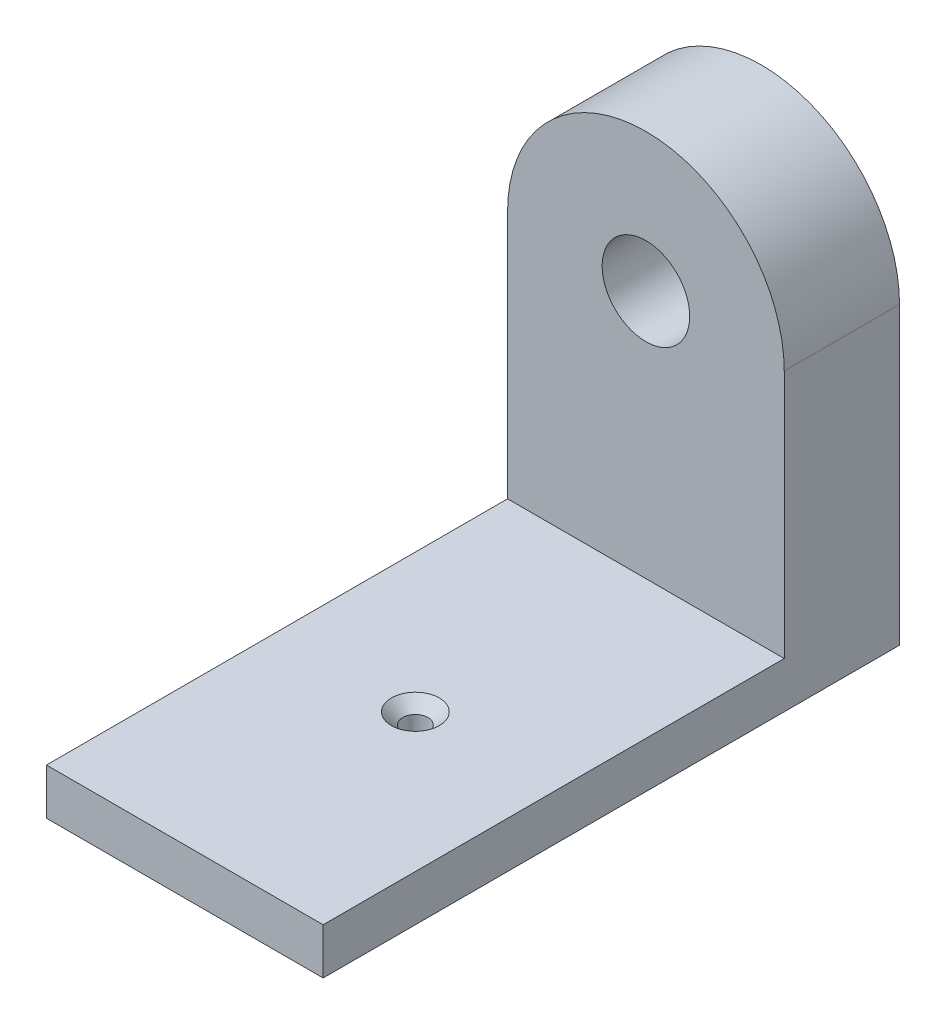
from build123d import *

# Parameters (mm, degrees)
SKETCH1_W                                            = 60
SKETCH1_H                                            = 125
BOSS_EXTRUDE1_DEPTH                                  = 10
SKETCH2_R                                            = 9.5
BOSS_EXTRUDE2_DEPTH                                  = 25
CSK_FOR_M5_COUNTERSUNK_RAISED_HEAD_SCREW_D           = 5.5
CSK_FOR_M5_COUNTERSUNK_RAISED_HEAD_SCREW_CSINK_D     = 10.4
CSK_FOR_M5_COUNTERSUNK_RAISED_HEAD_SCREW_CSINK_ANGLE = 90


with BuildPart() as part:
    # Sketch1 → Boss-Extrude1 (new body)
    with BuildSketch(Plane(origin=(0, 0, 0), x_dir=(1, 0, 0), z_dir=(0, 1, 0))):
        with Locations((30, 62.5)):
            Rectangle(SKETCH1_W, SKETCH1_H)
    extrude(amount=BOSS_EXTRUDE1_DEPTH)

    # Sketch2 → Boss-Extrude2 (add)
    with BuildSketch(Plane(origin=(0, 0, -125), x_dir=(-1, 0, 0), z_dir=(0, 0, -1))):
        with BuildLine():
            Line((-60, 10), (0, 10))
            Line((0, 10), (0, 64))
            ThreePointArc((0, 64), (-30, 94), (-60, 64))
            Line((-60, 64), (-60, 10))
        make_face()
        with Locations((-30, 64)):
            Circle(SKETCH2_R, mode=Mode.SUBTRACT)
    extrude(amount=-BOSS_EXTRUDE2_DEPTH)

    # CSK for M5 Countersunk Raised Head Screw1 (through all)
    with Locations(Plane(origin=(30, 10, -50), x_dir=(0, 0, 1), z_dir=(0, 1, 0))):
        with Locations((0, 0)):
            CounterSinkHole(CSK_FOR_M5_COUNTERSUNK_RAISED_HEAD_SCREW_D / 2, CSK_FOR_M5_COUNTERSUNK_RAISED_HEAD_SCREW_CSINK_D / 2, counter_sink_angle=CSK_FOR_M5_COUNTERSUNK_RAISED_HEAD_SCREW_CSINK_ANGLE)


solid = part.part
